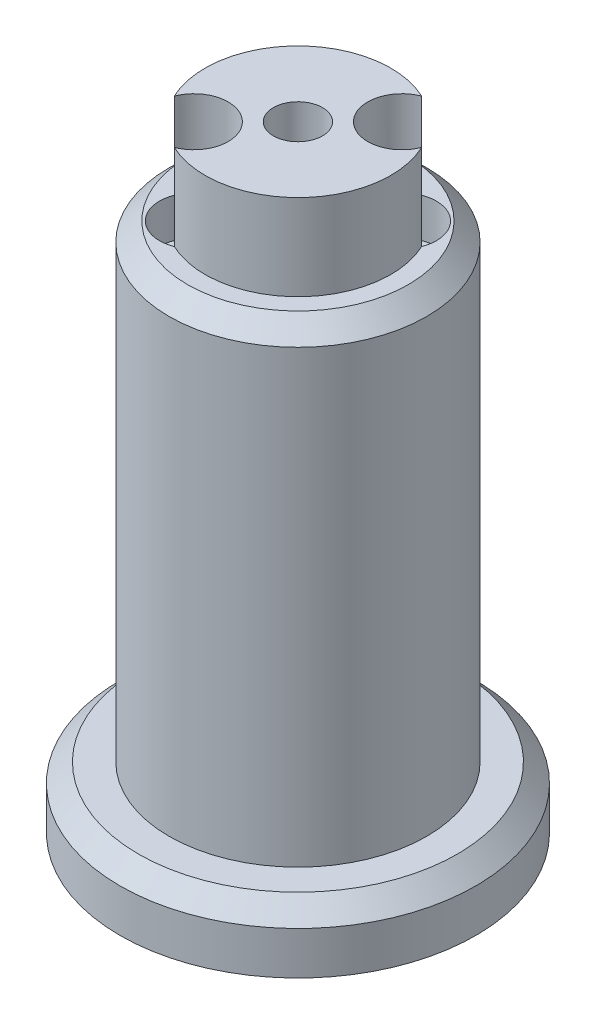
from build123d import *

# Parameters (mm, degrees)
SKETCH1_R              = 14.5
BOSS_EXTRUDE1_DEPTH    = 5
SKETCH2_R              = 13
CUT_EXTRUDE1_DEPTH     = 3
SKETCH6_R              = 10.5
BOSS_EXTRUDE3_DEPTH    = 45.2
CUT_EXTRUDE2_START     = -2
SKETCH3_R              = 3
SKETCH3_R_2            = 1.5
CUT_EXTRUDE2_DEPTH     = 5
BEARING_START          = -7
SKETCH7_R              = 10.5
SKETCH7_R_2            = 7.575
BEARING_SUPPORT_DEPTH  = 7
SKETCH8_R              = 2
SKETCH8_R_2            = 1.5
M4_HOLE_BORE_DEPTH     = 52.462024834
SKETCH9_R              = 2.8
M3_BOLT_RECESSES_DEPTH = 10.2
CHAMFER1_SIZE          = 1.5


with BuildPart() as part:
    # Sketch1 → Boss-Extrude1 (new body)
    with BuildSketch(Plane(origin=(0, 0, 0), x_dir=(1, 0, 0), z_dir=(0, 1, 0))):
        with Locations(Location((0, 0, 0), (0, 0, 270))):
            Circle(SKETCH1_R)
    extrude(amount=BOSS_EXTRUDE1_DEPTH)

    # Sketch2 → Cut-Extrude1 (cut)
    with BuildSketch(Plane.XZ):
        with Locations(Location((0, 0, 0), (0, 0, 270))):
            Circle(SKETCH2_R)
    extrude(amount=-CUT_EXTRUDE1_DEPTH, mode=Mode.SUBTRACT)

    # Sketch6 → Boss-Extrude3 (add)
    with BuildSketch(Plane(origin=(0, 5, 0), x_dir=(1, 0, 0), z_dir=(0, 1, 0))):
        with Locations(Location((0, 0, 0), (0, 0, 270))):
            Circle(SKETCH6_R)
    extrude(amount=BOSS_EXTRUDE3_DEPTH)

    # Sketch3 → Cut-Extrude2 (cut)
    with BuildSketch(Plane(origin=(0, 5, 0), x_dir=(1, 0, 0), z_dir=(0, 1, 0)).offset(CUT_EXTRUDE2_START)):
        with Locations(Location((0, 0, 0), (0, 0, 90))):
            Circle(SKETCH3_R)
        with Locations(Location((-4.242640687, 4.242640687, 0), (0, 0, 90))):
            Circle(SKETCH3_R_2)
        with Locations(Location((4.242640687, 4.242640687, 0), (0, 0, 90))):
            Circle(SKETCH3_R_2)
        with Locations(Location((4.242640687, -4.242640687, 0), (0, 0, 90))):
            Circle(SKETCH3_R_2)
        with Locations(Location((-4.242640687, -4.242640687, 0), (0, 0, 90))):
            Circle(SKETCH3_R_2)
    extrude(amount=CUT_EXTRUDE2_DEPTH, mode=Mode.SUBTRACT)

    # Sketch7 → Bearing Support (cut)
    with BuildSketch(Plane(origin=(0, 50.2, 0), x_dir=(1, 0, 0), z_dir=(0, 1, 0)).offset(BEARING_START)):
        with Locations(Location((0, 0, 0), (0, 0, 270))):
            Circle(SKETCH7_R)
        with Locations(Location((0, 0, 0), (0, 0, 270))):
            Circle(SKETCH7_R_2, mode=Mode.SUBTRACT)
    extrude(amount=BEARING_SUPPORT_DEPTH, mode=Mode.SUBTRACT)

    # Sketch8 → M4 Hole Bore (cut, through all)
    with BuildSketch(Plane.XZ.offset(-3)):
        with Locations(Location((0, 0, 0), (0, 0, 270))):
            Circle(SKETCH8_R)
        with Locations(Location((-4.242640687, 4.242640687, 0), (0, 0, 270))):
            Circle(SKETCH8_R_2)
        with Locations(Location((4.242640687, -4.242640687, 0), (0, 0, 270))):
            Circle(SKETCH8_R_2)
    extrude(amount=-M4_HOLE_BORE_DEPTH, mode=Mode.SUBTRACT)

    # Sketch9 → M3 Bolt Recesses (cut)
    with BuildSketch(Plane(origin=(0, 50.2, 0), x_dir=(1, 0, 0), z_dir=(0, 1, 0))):
        with Locations(Location((4.242640687, 4.242640687, 0), (0, 0, 270))):
            Circle(SKETCH9_R)
        with Locations(Location((-4.242640687, -4.242640687, 0), (0, 0, 270))):
            Circle(SKETCH9_R)
    extrude(amount=-M3_BOLT_RECESSES_DEPTH, mode=Mode.SUBTRACT)

    # Chamfer1
    chamfer1_edges = [part.edges().sort_by_distance(p)[0] for p in [
        (0, 43.2, -10.5),
        (0, 5, -14.5),
    ]]
    chamfer(chamfer1_edges, length=CHAMFER1_SIZE)


solid = part.part
